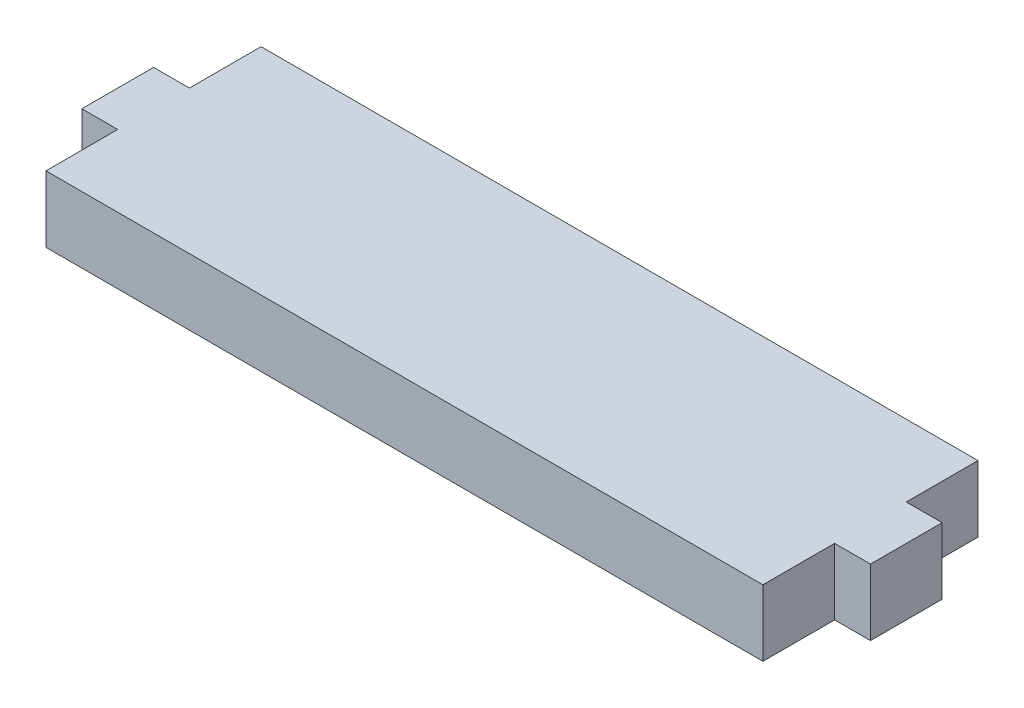
from build123d import *

# Parameters (mm, degrees)
SKETCH1_W           = 40
SKETCH1_H           = 4
SKETCH1_W_2         = 2
BOSS_EXTRUDE1_DEPTH = 3.7


with BuildPart() as part:
    # Sketch1 → Boss-Extrude1 (new body)
    with BuildSketch(Plane(origin=(0, 0, 0), x_dir=(1, 0, 0), z_dir=(0, 1, 0))):
        Polygon((-15.330595421, 3.400821374), (-17.330595421, 3.400821374), (-17.330595421, -0.599178626), (-15.330595421, -0.599178626), (24.669404579, -0.599178626), (24.669404579, 3.400821374), align=None)
        with Locations((4.669404579, -2.599178626)):
            Rectangle(SKETCH1_W, SKETCH1_H)
        with Locations((25.669404579, 1.400821374)):
            Rectangle(SKETCH1_W_2, SKETCH1_H)
        with Locations((4.669404579, 5.400821374)):
            Rectangle(SKETCH1_W, SKETCH1_H)
    extrude(amount=BOSS_EXTRUDE1_DEPTH)


solid = part.part
